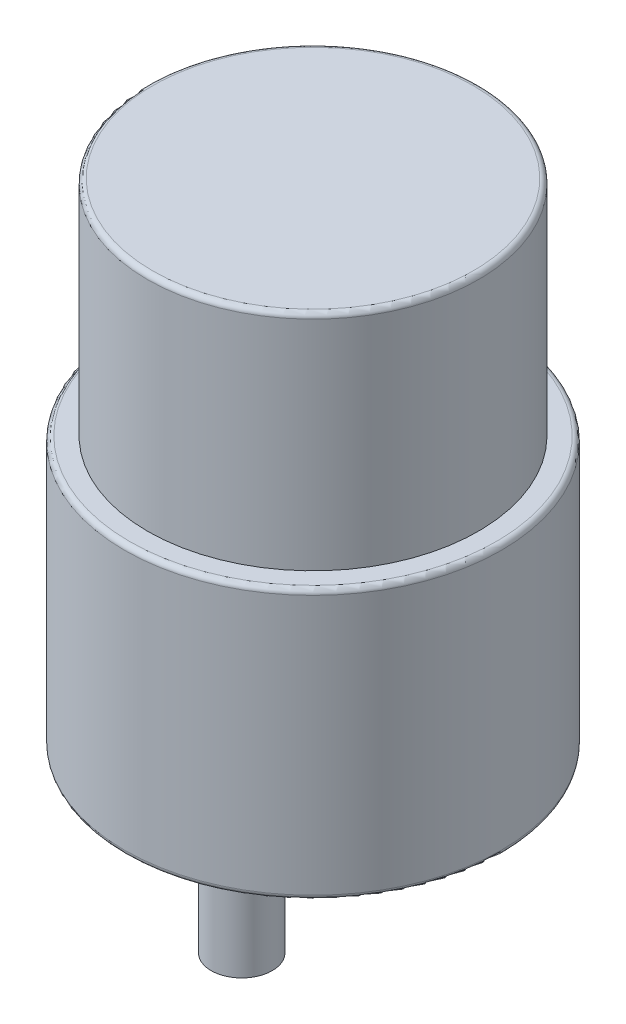
from build123d import *

# Parameters (mm, degrees)
SKETCH_1_R          = 18.5
EXTRUDE_1_DEPTH     = 26.5
SKETCH_2_R          = 16.25
EXTRUDE_2_DEPTH     = 21.9
SKETCH_3_R          = 6
EXTRUDE_3_DEPTH     = 6
SKETCH_4_R          = 3
EXTRUDE_4_DEPTH     = 15
CUT_EXTRUDE_START   = -12
CUT_EXTRUDE_1_DEPTH = 12
FILLET_1_R          = 0.5
SKETCH_6_R          = 1.5
CUT_EXTRUDE_2_DEPTH = 3


with BuildPart() as part:
    # 草图1 → 凸台-拉伸1 (new body)
    with BuildSketch(Plane(origin=(0, 0, 0), x_dir=(1, 0, 0), z_dir=(0, 1, 0))):
        with Locations(Location((0, 0, 0), (0, 0, 270))):
            Circle(SKETCH_1_R)
    extrude(amount=EXTRUDE_1_DEPTH)

    # 草图2 → 凸台-拉伸2 (add)
    with BuildSketch(Plane(origin=(0, 26.5, 0), x_dir=(1, 0, 0), z_dir=(0, 1, 0))):
        with Locations(Location((0, 0, 0), (0, 0, 270))):
            Circle(SKETCH_2_R)
    extrude(amount=EXTRUDE_2_DEPTH)

    # 草图3 → 凸台-拉伸3 (add)
    with BuildSketch(Plane.XZ):
        with Locations(Location((-7, 0, 0), (0, 0, 90))):
            Circle(SKETCH_3_R)
    extrude(amount=EXTRUDE_3_DEPTH)

    # 草图4 → 凸台-拉伸4 (add)
    with BuildSketch(Plane.XZ.offset(6)):
        with Locations(Location((-7, 0, 0), (0, 0, 270))):
            Circle(SKETCH_4_R)
    extrude(amount=EXTRUDE_4_DEPTH)

    # 草图5 → 切除-拉伸1 (cut)
    with BuildSketch(Plane.XZ.offset(21).offset(CUT_EXTRUDE_START)):
        with BuildLine():
            Line((-9.4, -1.8), (-9.4, 1.8))
            ThreePointArc((-9.4, 1.8), (-10, 0), (-9.4, -1.8))
        make_face()
    extrude(amount=CUT_EXTRUDE_1_DEPTH, mode=Mode.SUBTRACT)

    # 圆角1
    fillet_1_edges = [part.edges().sort_by_distance(p)[0] for p in [
        (0, 0, -18.5),
        (0, 26.5, -18.5),
        (0, 48.4, -16.25),
    ]]
    fillet(fillet_1_edges, radius=FILLET_1_R)

    # 草图6 → 切除-拉伸2 (cut)
    with BuildSketch(Plane.XZ):
        with Locations(Location((0, -15.5, 0), (0, 0, 270))):
            Circle(SKETCH_6_R)
        with Locations(Location((-13.423393759, -7.75, 0), (0, 0, 270))):
            Circle(SKETCH_6_R)
        with Locations(Location((-13.423393759, 7.75, 0), (0, 0, 270))):
            Circle(SKETCH_6_R)
        with Locations(Location((0, 15.5, 0), (0, 0, 270))):
            Circle(SKETCH_6_R)
        with Locations(Location((13.423393759, 7.75, 0), (0, 0, 270))):
            Circle(SKETCH_6_R)
        with Locations(Location((13.423393759, -7.75, 0), (0, 0, 270))):
            Circle(SKETCH_6_R)
    extrude(amount=-CUT_EXTRUDE_2_DEPTH, mode=Mode.SUBTRACT)


solid = part.part
